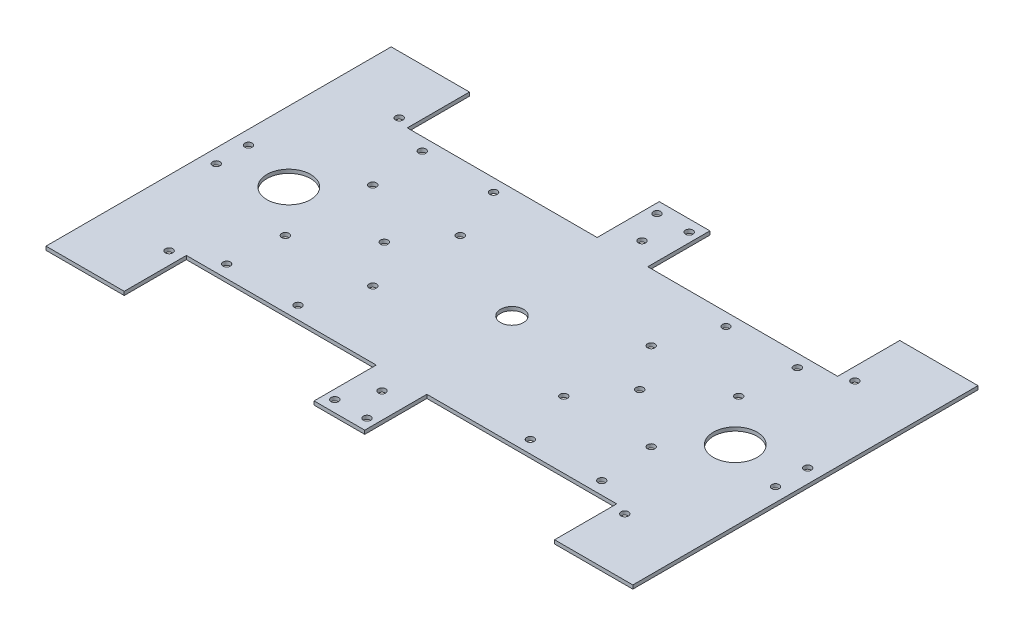
from build123d import *

# Parameters (mm, degrees)
SKETCH_2_R          = 5
EXTRUDE_1_DEPTH     = 0.8
SKETCH_5_R          = 1.6
SKETCH_5_R_2        = 9.5
CUT_EXTRUDE_1_DEPTH = 2


with BuildPart() as part:
    # 草图2 → 凸台-拉伸1 (new, symmetric)
    with BuildSketch(Plane(origin=(0, 0, 0), x_dir=(1, 0, 0), z_dir=(0, 1, 0))):
        Polygon((-127.5, 75), (-127.5, -75), (-93.5, -75), (-93.5, -48), (-11, -48), (-11, -75), (11, -75), (11, -48), (93.5, -48), (93.5, -75), (127.5, -75), (127.5, 75), (93.5, 75), (93.5, 48), (11, 48), (11, 75), (-11, 75), (-11, 48), (-93.5, 48), (-93.5, 75), align=None)
        with Locations(Location((0, 0, 0), (0, 0, 270))):
            Circle(SKETCH_2_R, mode=Mode.SUBTRACT)
    extrude(amount=EXTRUDE_1_DEPTH, both=True)

    # 草图5 → 切除-拉伸1 (cut)
    with BuildSketch(Plane.XZ.offset(0.8)):
        with Locations(Location((-55.5, 0, 0), (0, 0, 270))):
            Circle(SKETCH_5_R)
        with Locations(Location((0, 56.5, 0), (0, 0, 270))):
            Circle(SKETCH_5_R)
        with Locations(Location((7, 70, 0), (0, 0, 270))):
            Circle(SKETCH_5_R)
        with Locations(Location((-7, 70, 0), (0, 0, 270))):
            Circle(SKETCH_5_R)
        with Locations(Location((99, 50, 0), (0, 0, 270))):
            Circle(SKETCH_5_R)
        with Locations(Location((-81.5, -42.5, 0), (0, 0, 270))):
            Circle(SKETCH_5_R)
        with Locations(Location((-50.5, -42.5, 0), (0, 0, 270))):
            Circle(SKETCH_5_R)
        with Locations(Location((-99, -50, 0), (0, 0, 270))):
            Circle(SKETCH_5_R)
        with Locations(Location((-97, 0, 0), (0, 0, 270))):
            Circle(SKETCH_5_R_2)
        with Locations(Location((-121.5, -7, 0), (0, 0, 270))):
            Circle(SKETCH_5_R)
        with Locations(Location((55.5, 0, 0), (0, 0, 90))):
            Circle(SKETCH_5_R)
        with Locations(Location((81.5, -42.5, 0), (0, 0, 90))):
            Circle(SKETCH_5_R)
        with Locations(Location((50.5, -42.5, 0), (0, 0, 90))):
            Circle(SKETCH_5_R)
        with Locations(Location((99, -50, 0), (0, 0, 90))):
            Circle(SKETCH_5_R)
        with Locations(Location((121.5, -7, 0), (0, 0, 90))):
            Circle(SKETCH_5_R)
        with Locations(Location((97, 0, 0), (0, 0, 270))):
            Circle(SKETCH_5_R_2)
        with Locations(Location((7, -70, 0), (0, 0, 90))):
            Circle(SKETCH_5_R)
        with Locations(Location((-7, -70, 0), (0, 0, 90))):
            Circle(SKETCH_5_R)
        with Locations(Location((0, -56.5, 0), (0, 0, 90))):
            Circle(SKETCH_5_R)
        with Locations(Location((50.5, 42.5, 0), (0, 0, 270))):
            Circle(SKETCH_5_R)
        with Locations(Location((81.5, 42.5, 0), (0, 0, 270))):
            Circle(SKETCH_5_R)
        with Locations(Location((121.5, 7, 0), (0, 0, 270))):
            Circle(SKETCH_5_R)
        with Locations(Location((-50.5, 42.5, 0), (0, 0, 90))):
            Circle(SKETCH_5_R)
        with Locations(Location((-121.5, 7, 0), (0, 0, 90))):
            Circle(SKETCH_5_R)
        with Locations(Location((-81.5, 42.5, 0), (0, 0, 90))):
            Circle(SKETCH_5_R)
        with Locations(Location((-99, 50, 0), (0, 0, 90))):
            Circle(SKETCH_5_R)
        with Locations(Location((-79.5, 19, 0), (0, 0, 270))):
            Circle(SKETCH_5_R)
        with Locations(Location((-41.5, 19, 0), (0, 0, 270))):
            Circle(SKETCH_5_R)
        with Locations(Location((-41.5, -19, 0), (0, 0, 90))):
            Circle(SKETCH_5_R)
        with Locations(Location((-79.5, -19, 0), (0, 0, 270))):
            Circle(SKETCH_5_R)
        with Locations(Location((41.5, 19, 0), (0, 0, 90))):
            Circle(SKETCH_5_R)
        with Locations(Location((79.5, 19, 0), (0, 0, 90))):
            Circle(SKETCH_5_R)
        with Locations(Location((41.5, -19, 0), (0, 0, 270))):
            Circle(SKETCH_5_R)
        with Locations(Location((79.5, -19, 0), (0, 0, 270))):
            Circle(SKETCH_5_R)
    extrude(amount=-CUT_EXTRUDE_1_DEPTH, mode=Mode.SUBTRACT)


solid = part.part
